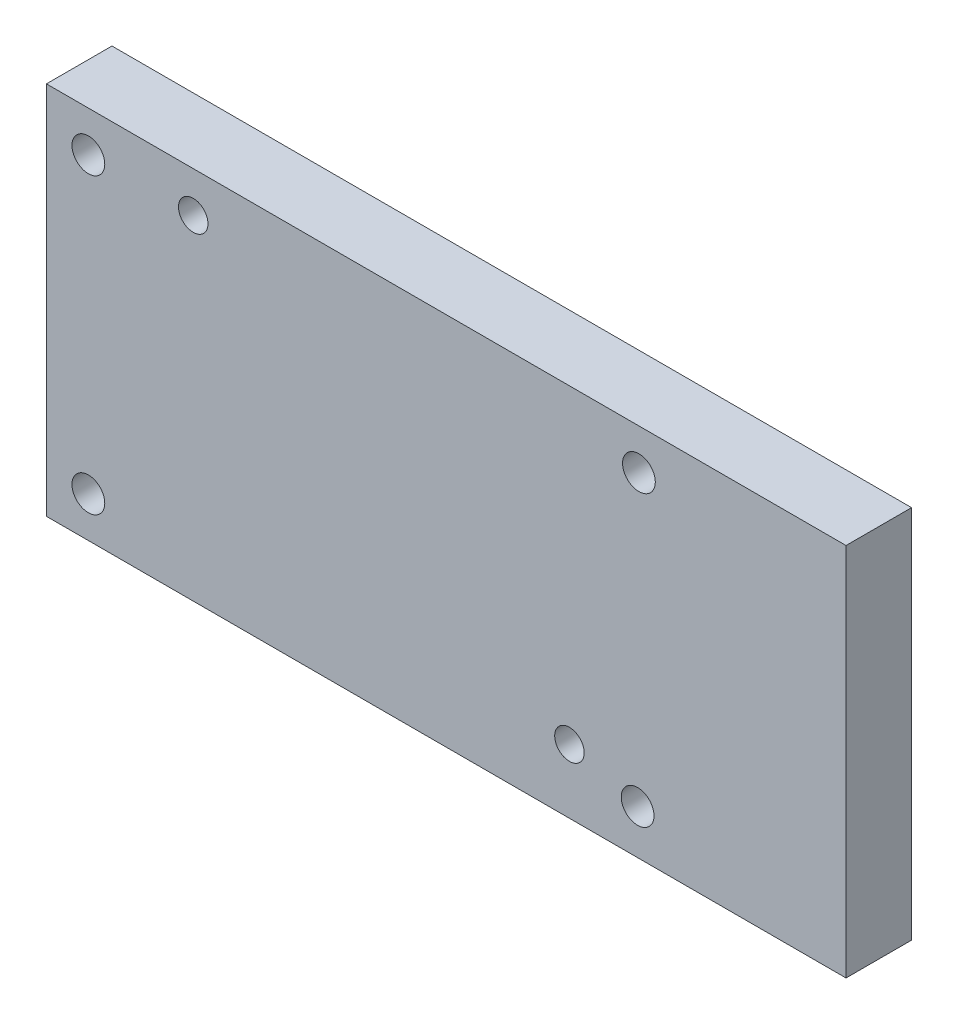
from build123d import *

# Parameters (mm, degrees)
SKETCH1_W           = 61
SKETCH1_H           = 28.575
SKETCH1_R           = 1.25
SKETCH1_R_2         = 1.125
BOSS_EXTRUDE1_DEPTH = 5


with BuildPart() as part:
    # Sketch1 → Boss-Extrude1 (new body)
    with BuildSketch(Plane.XY):
        with Locations((-30.5, 14.2875)):
            Rectangle(SKETCH1_W, SKETCH1_H)
        with Locations((-57.8, 3.0875)):
            Circle(SKETCH1_R, mode=Mode.SUBTRACT)
        with Locations((-57.8, 25.4875)):
            Circle(SKETCH1_R, mode=Mode.SUBTRACT)
        with Locations((-15.8, 25.4875)):
            Circle(SKETCH1_R, mode=Mode.SUBTRACT)
        with Locations((-15.9, 3.3875)):
            Circle(SKETCH1_R, mode=Mode.SUBTRACT)
        with Locations((-49.8, 25.4875)):
            Circle(SKETCH1_R_2, mode=Mode.SUBTRACT)
        with Locations((-21.1, 4.8875)):
            Circle(SKETCH1_R_2, mode=Mode.SUBTRACT)
    extrude(amount=BOSS_EXTRUDE1_DEPTH)


solid = part.part
